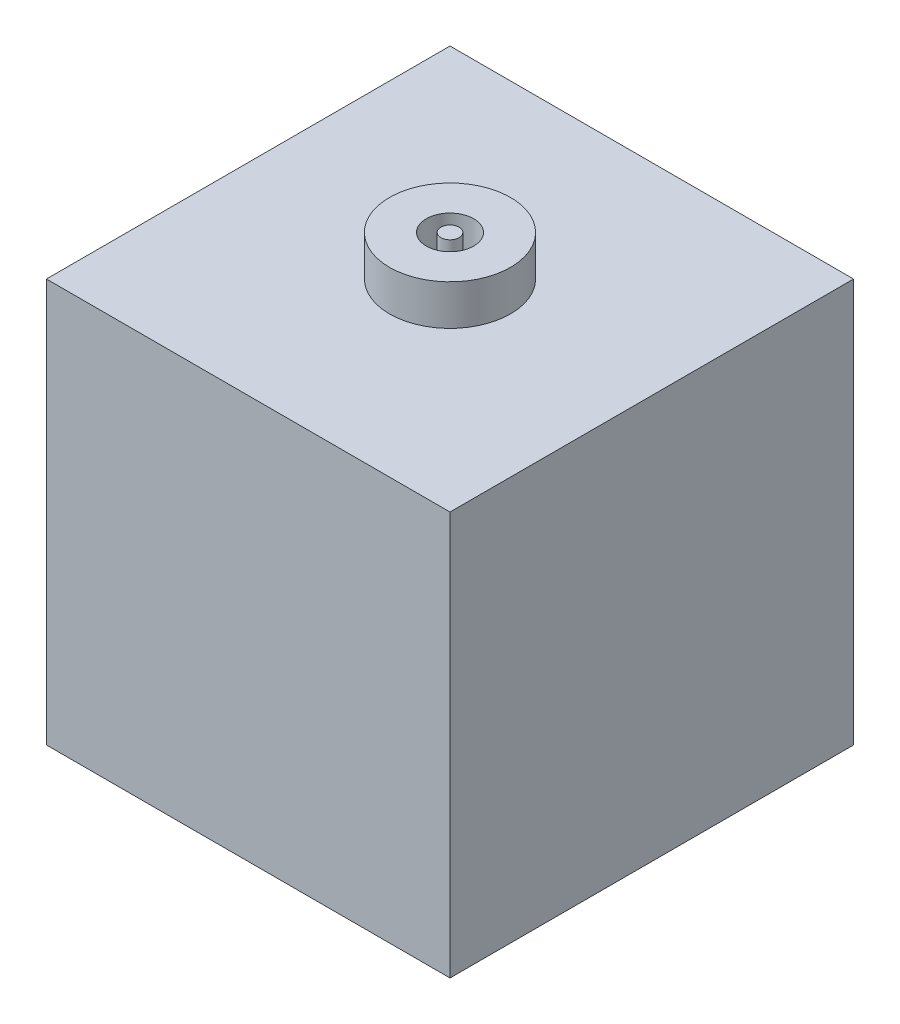
from build123d import *

# Parameters (mm, degrees)
SKETCH_1_W      = 40
SKETCH_1_H      = 40
EXTRUDE_1_DEPTH = 40
SKETCH_1_3_R    = 6
SKETCH_1_3_R_2  = 2.35
SKETCH_1_3_R_3  = 0.9
EXTRUDE_2_DEPTH = 4


with BuildPart() as part:
    # 草图1 → 凸台-拉伸1 (new body)
    with BuildSketch(Plane(origin=(0, 0, 0), x_dir=(1, 0, 0), z_dir=(0, 1, 0))):
        with Locations((20, 20)):
            Rectangle(SKETCH_1_W, SKETCH_1_H)
    extrude(amount=-EXTRUDE_1_DEPTH)

    # 草图1<3> → 凸台-拉伸2 (add)
    # profile 1 of 2: a face of its own
    with BuildSketch(Plane(origin=(0, 0, 0), x_dir=(1, 0, 0), z_dir=(0, 1, 0))):
        with Locations((20, 20)):
            Circle(SKETCH_1_3_R)
        with Locations((20, 20)):
            Circle(SKETCH_1_3_R_2, mode=Mode.SUBTRACT)
    # profile 2 of 2: a face of its own
    with BuildSketch(Plane(origin=(0, 0, 0), x_dir=(1, 0, 0), z_dir=(0, 1, 0))):
        with Locations((20, 20)):
            Circle(SKETCH_1_3_R_3)
    extrude(amount=EXTRUDE_2_DEPTH)


solid = part.part
